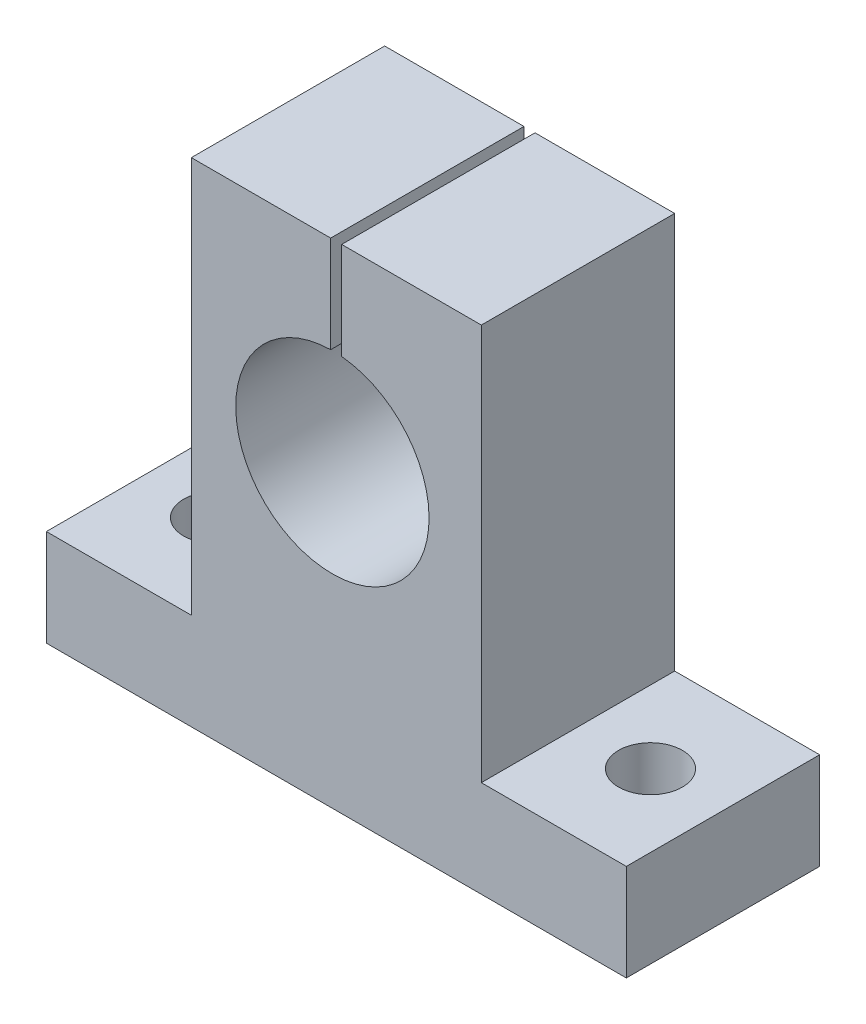
from build123d import *

# Parameters (mm, degrees)
SKETCH1_W           = 60
SKETCH1_H           = 51
BOSS_EXTRUDE1_DEPTH = 20
SKETCH2_W           = 15
SKETCH2_H           = 41
CUT_EXTRUDE1_DEPTH  = 20
SKETCH3_R           = 10
CUT_EXTRUDE2_DEPTH  = 20
SKETCH4_R           = 3.3
CUT_EXTRUDE3_DEPTH  = 20
SKETCH7_W           = 1.141811335
SKETCH7_H           = 10.046427162
CUT_EXTRUDE4_DEPTH  = 20
SCALE1_SCALE        = 0.8
SCALE2_SCALE        = 0.5


with BuildPart() as part:
    # Sketch1 → Boss-Extrude1 (new body)
    with BuildSketch(Plane.XY):
        with Locations((-612.687747036, 357.503952569)):
            Rectangle(SKETCH1_W, SKETCH1_H)
    extrude(amount=BOSS_EXTRUDE1_DEPTH)

    # Sketch2 → Cut-Extrude1 (cut)
    with BuildSketch(Plane.XY.offset(20)):
        with Locations((-635.187747036, 362.503952569)):
            Rectangle(SKETCH2_W, SKETCH2_H)
        with Locations((-590.187747036, 362.503952569)):
            Rectangle(SKETCH2_W, SKETCH2_H)
    extrude(amount=-CUT_EXTRUDE1_DEPTH, mode=Mode.SUBTRACT)

    # Sketch3 → Cut-Extrude2 (cut)
    with BuildSketch(Plane.XY.offset(20)):
        with Locations((-613.095017258, 363.003952569)):
            Circle(SKETCH3_R)
    extrude(amount=-CUT_EXTRUDE2_DEPTH, mode=Mode.SUBTRACT)

    # Sketch4 → Cut-Extrude3 (cut)
    with BuildSketch(Plane(origin=(0, 342.003952569, 0), x_dir=(1, 0, 0), z_dir=(0, 1, 0))):
        with Locations(Location((-635.187747036, -10, 0), (0, 0, 270))):
            Circle(SKETCH4_R)
        with Locations(Location((-590.187747036, -10, 0), (0, 0, 270))):
            Circle(SKETCH4_R)
    extrude(amount=-CUT_EXTRUDE3_DEPTH, mode=Mode.SUBTRACT)

    # Sketch7 → Cut-Extrude4 (cut)
    with BuildSketch(Plane.XY.offset(20)):
        with Locations((-612.703432528, 377.980738988)):
            Rectangle(SKETCH7_W, SKETCH7_H)
    extrude(amount=-CUT_EXTRUDE4_DEPTH, mode=Mode.SUBTRACT)


with BuildPart() as part_1:
    # Scale1: scaled about (-612.600600691, 352.463239706, 10)
    add(part.part.scale(SCALE1_SCALE).moved(Location((-122.520120138, 70.492647941, 2))))


with BuildPart() as part_2:
    # Scale2: scaled about (-612.600600691, 352.463239706, 10)
    add(part_1.part.scale(SCALE2_SCALE).moved(Location((-306.300300345, 176.231619853, 5))))


solid = part_2.part
